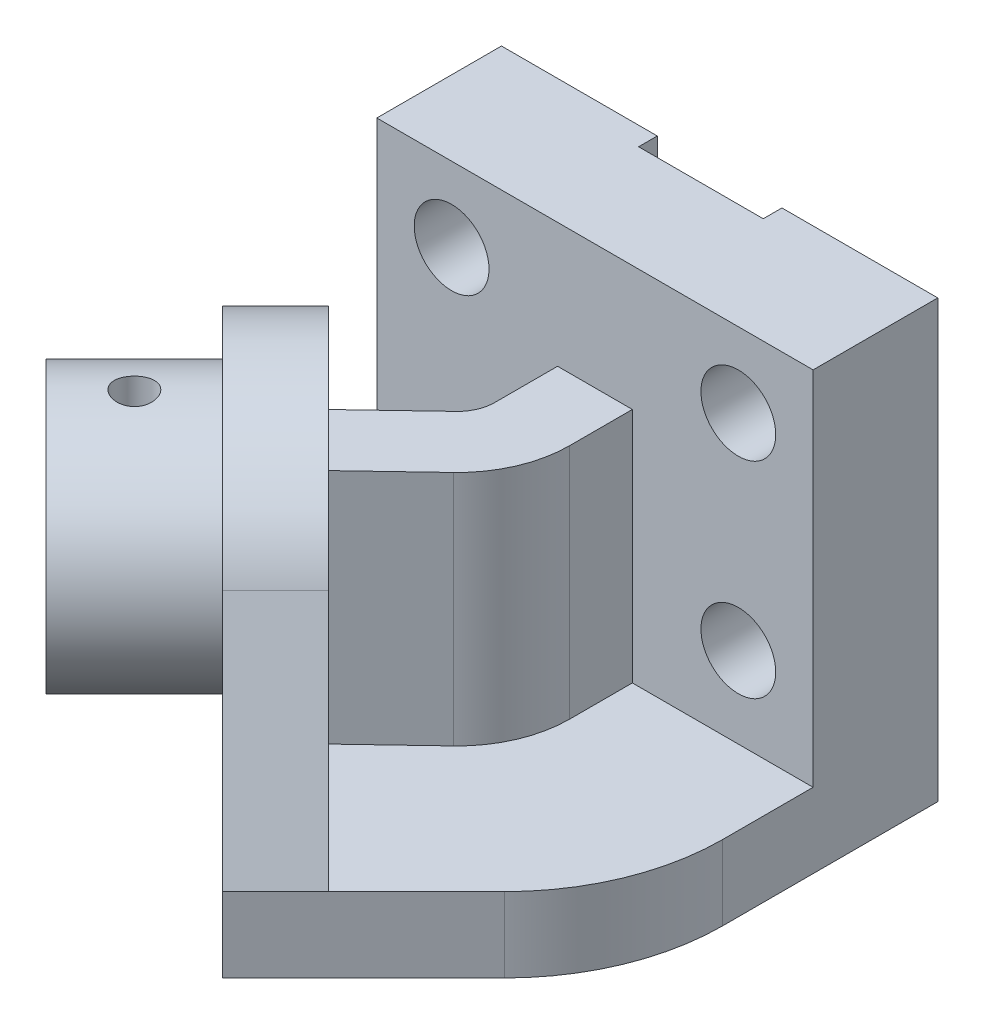
from build123d import *

# Parameters (mm, degrees)
BOSS_EXTRUDE1_DEPTH       = 35
BOSS_EXTRUDE2_DEPTH       = 12
BOSS_EXTRUDE3_DEPTH       = 12
SKETCH4_R                 = 19
BOSS_EXTRUDE4_DEPTH       = 20
BOSS_EXTRUDE5_DEPTH       = 38
SKETCH7_W                 = 6
SKETCH7_H                 = 100
LPATTERN1_COUNT           = 2
LPATTERN1_PITCH           = 33
LPATTERN2_COUNT           = 2
LPATTERN2_PITCH           = 46
LPATTERN2_COPY_1_SKETCH_W = 6
LPATTERN2_COPY_1_SKETCH_H = 100
SKETCH8_R                 = 3
CUT_EXTRUDE1_DEPTH        = 108.736551619


with BuildPart() as part:
    # Sketch1 → Boss-Extrude1 (new, symmetric)
    with BuildSketch(Plane(origin=(0, 0, 0), x_dir=(1, 0, 0), z_dir=(0, 1, 0))):
        Polygon((-10, 20), (-10, 17), (10, 17), (10, 20), (35, 20), (35, 0), (-35, 0), (-35, 20), align=None)
    extrude(amount=BOSS_EXTRUDE1_DEPTH, both=True)

    # Sketch2 → Boss-Extrude2 (add)
    with BuildSketch(Plane(origin=(0, -35, 0), x_dir=(-1, 0, 0), z_dir=(0, -1, 0))):
        with BuildLine():
            Line((-35, 0), (35, 0))
            Line((35, 0), (47.377416998, -12.377416998))
            Line((47.377416998, -12.377416998), (-2.121320344, -61.876154339))
            Line((-2.121320344, -61.876154339), (-24.748737342, -39.248737342))
            ThreePointArc((-24.748737342, -39.248737342), (-32.335783638, -27.893920133), (-35, -14.5))
            Line((-35, -14.5), (-35, 0))
        make_face()
    extrude(amount=-BOSS_EXTRUDE2_DEPTH)

    # Sketch3 → Boss-Extrude3 (add)
    with BuildSketch(Plane(origin=(-29.877416998, 0, 29.877416998), x_dir=(0.7071067811865468, 0, 0.7071067811865482), z_dir=(-0.7071067811865482, 0, 0.7071067811865468))):
        with BuildLine():
            Line((-24.748737342, -23), (-13.468721173, 10.894302389))
            ThreePointArc((-13.468721173, 10.894302389), (10.252155493, 28), (33.973032159, 10.894302389))
            Line((33.973032159, 10.894302389), (45.253048327, -23))
            Line((45.253048327, -23), (-24.748737342, -23))
        make_face()
    extrude(amount=-BOSS_EXTRUDE3_DEPTH)

    # Sketch4 → Boss-Extrude4 (add)
    with BuildSketch(Plane(origin=(-29.877416998, 0, 29.877416998), x_dir=(0.7071067811865468, 0, 0.7071067811865482), z_dir=(-0.7071067811865482, 0, 0.7071067811865468))):
        with Locations((10.252155493, 3)):
            Circle(SKETCH4_R)
    extrude(amount=BOSS_EXTRUDE4_DEPTH)

    # Sketch5 → Boss-Extrude5 (add)
    with BuildSketch(Plane(origin=(0, -23, 0), x_dir=(1, 0, 0), z_dir=(0, 1, 0))):
        with BuildLine():
            Line((-6, 0), (-6, -10.063607341))
            ThreePointArc((-6, -10.063607341), (-6.487174562, -12.431888509), (-7.869585231, -14.415580897))
            Line((-7.869585231, -14.415580897), (-18.386854658, -24.39741659))
            Line((-18.386854658, -24.39741659), (-9.898679248, -32.885591999))
            Line((-9.898679248, -32.885591999), (0.391244308, -23.119528009))
            ThreePointArc((0.391244308, -23.119528009), (4.538476314, -17.168450846), (6, -10.063607341))
            Line((6, -10.063607341), (6, 0))
            Line((6, 0), (-6, 0))
        make_face()
    extrude(amount=BOSS_EXTRUDE5_DEPTH)

    # Sketch7 → Hole1 (revolve, cut)
    with BuildSketch(Plane(origin=(23, -10, 0), x_dir=(0, -1, 0), z_dir=(1, 0, 0))):
        with Locations((3, 50)):
            Rectangle(SKETCH7_W, SKETCH7_H)
    hole1 = revolve(axis=Axis((23, -10, -110), (0, 0, 1)), mode=Mode.SUBTRACT)

    # LPattern1: Hole1 ×2
    with Locations(*[(0, i * LPATTERN1_PITCH, 0) for i in range(1, LPATTERN1_COUNT)]):
        add(hole1, mode=Mode.SUBTRACT)

    # LPattern2: Hole1 ×2
    with Locations(*[(-i * LPATTERN2_PITCH, 0, 0) for i in range(1, LPATTERN2_COUNT)]):
        add(hole1, mode=Mode.SUBTRACT)

    # LPattern2 copy 1 sketch → LPattern2 copy 1 (revolve, cut)
    with BuildSketch(Plane(origin=(-23, 23, 0), x_dir=(0, -1, 0), z_dir=(1, 0, 0))):
        with Locations((3, 50)):
            Rectangle(LPATTERN2_COPY_1_SKETCH_W, LPATTERN2_COPY_1_SKETCH_H)
    revolve(axis=Axis((-23, 23, -110), (0, 0, 1)), mode=Mode.SUBTRACT)

    # Sketch8 → Cut-Extrude1 (cut, through all)
    with BuildSketch(Plane(origin=(0, 35, 0), x_dir=(1, 0, 0), z_dir=(0, 1, 0))):
        with Locations(Location((-29.699116139, -44.197853481, 0), (0, 0, 270))):
            Circle(SKETCH8_R)
    extrude(amount=-CUT_EXTRUDE1_DEPTH, mode=Mode.SUBTRACT)


solid = part.part
